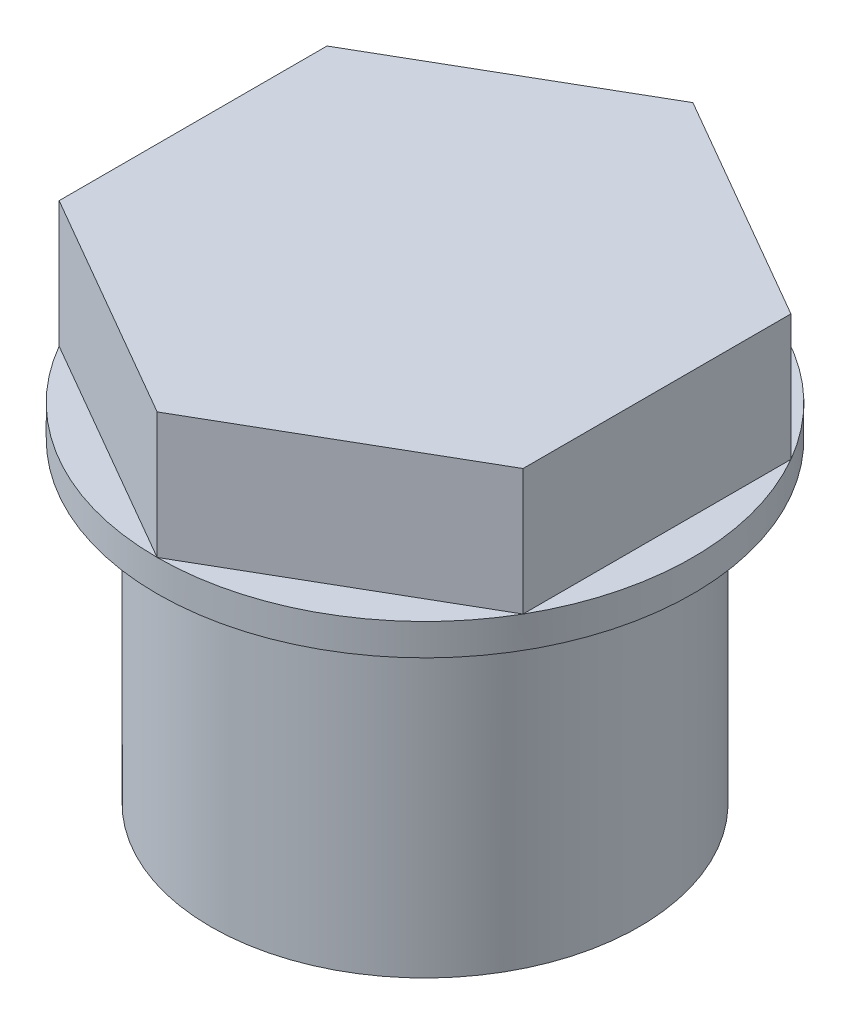
from build123d import *

# Parameters (mm, degrees)
SKETCH1_R      = 8.5
EXTRUDE1_DEPTH = 1
EXTRUDE2_DEPTH = 4
SKETCH3_R      = 6.8
EXTRUDE3_DEPTH = 10


with BuildPart() as part:
    # Sketch1 → Extrude1 (new body)
    with BuildSketch(Plane(origin=(0, 0, 0), x_dir=(1, 0, 0), z_dir=(0, 1, 0))):
        with Locations(Location((0, 0, 0), (0, 0, 270))):
            Circle(SKETCH1_R)
    extrude(amount=EXTRUDE1_DEPTH)

    # Sketch2 → Extrude2 (add)
    with BuildSketch(Plane(origin=(0, 1, 0), x_dir=(1, 0, 0), z_dir=(0, 1, 0))):
        Polygon((0, 8.5), (-7.361215932, 4.25), (-7.361215932, -4.25), (0, -8.5), (7.361215932, -4.25), (7.361215932, 4.25), align=None)
    extrude(amount=EXTRUDE2_DEPTH)

    # Sketch3 → Extrude3 (add)
    with BuildSketch(Plane.XZ):
        with Locations(Location((0, 0, 0), (0, 0, 90))):
            Circle(SKETCH3_R)
    extrude(amount=EXTRUDE3_DEPTH)


solid = part.part
